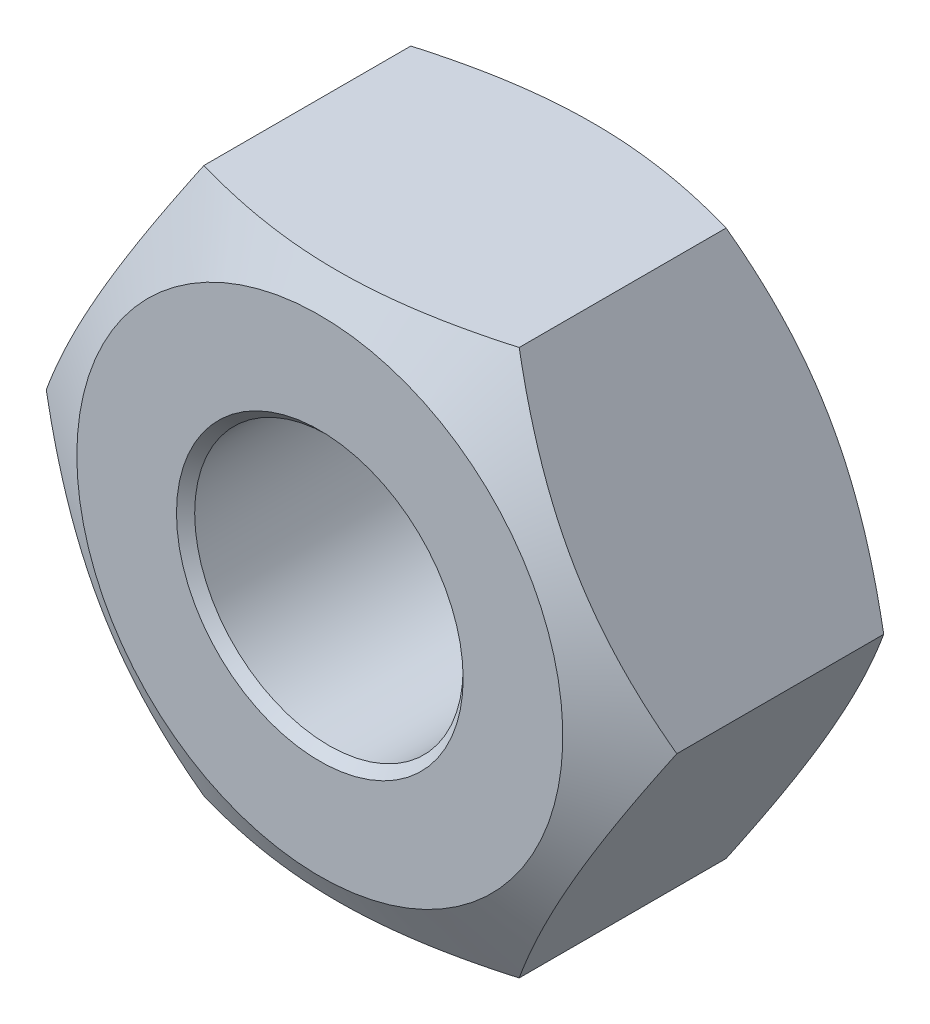
from build123d import *

# Parameters (mm, degrees)
SKETCH1_R        = 2.4585
BASENUT_DEPTH    = 5
ENDCHAMFER2_SIZE = 0.166666667


with BuildPart() as part:
    # Sketch1 → BaseNut (new body)
    with BuildSketch(Plane.XY):
        Polygon((2.886751346, -5), (5.773502692, 0), (2.886751346, 5), (-2.886751346, 5), (-5.773502692, 0), (-2.886751346, -5), align=None)
        Circle(SKETCH1_R, mode=Mode.SUBTRACT)
    extrude(amount=-BASENUT_DEPTH)

    # Sketch2 → Chamfer1 (revolve, cut)
    with BuildSketch(Plane(origin=(15.04811501, 0, -16.706149795), x_dir=(0, 0, -1), z_dir=(0, 1, 0))):
        Polygon((-12.152731783, 20.821617702), (-11.706149795, 20.04811501), (-11.706149795, 20.821617702), align=None)
    revolve(axis=Axis((0, 0, 7.016501752), (0, 0, -1)), mode=Mode.SUBTRACT)

    # Sketch6 → EndChamfer1 (revolve, cut)
    with BuildSketch(Plane(origin=(-9.197458863, 0, -10.252541137), x_dir=(0, 0, 1), z_dir=(0, 1, 0))):
        Polygon((5.252541137, 11.655958863), (5.252541137, 12.572458863), (5.781682659, 11.655958863), align=None)
    revolve(axis=Axis((0, 0, 13.104863586), (0, 0, -1)), mode=Mode.SUBTRACT)

    # Sketch5 → Chamfer2 (revolve, cut)
    with BuildSketch(Plane(origin=(-14.793032735, 0, -16.96123207), x_dir=(0, 0, 1), z_dir=(0, 1, 0)), mode=Mode.PRIVATE) as chamfer2_sk:
        Polygon((16.96123207, 19.243032735), (16.96123207, 20.566535427), (16.197107435, 20.566535427), align=None)
    revolve(chamfer2_sk.sketch.rotate(Axis((0, 0, -39.536013381), (0, 0, 1)), 180), axis=Axis((0, 0, -39.536013381), (0, 0, 1)), mode=Mode.SUBTRACT)

    # EndChamfer2
    endchamfer2_edges = [part.edges().sort_by_distance(p)[0] for p in [
        (-2.4585, 0, 0),
    ]]
    chamfer(endchamfer2_edges, length=ENDCHAMFER2_SIZE)


solid = part.part
